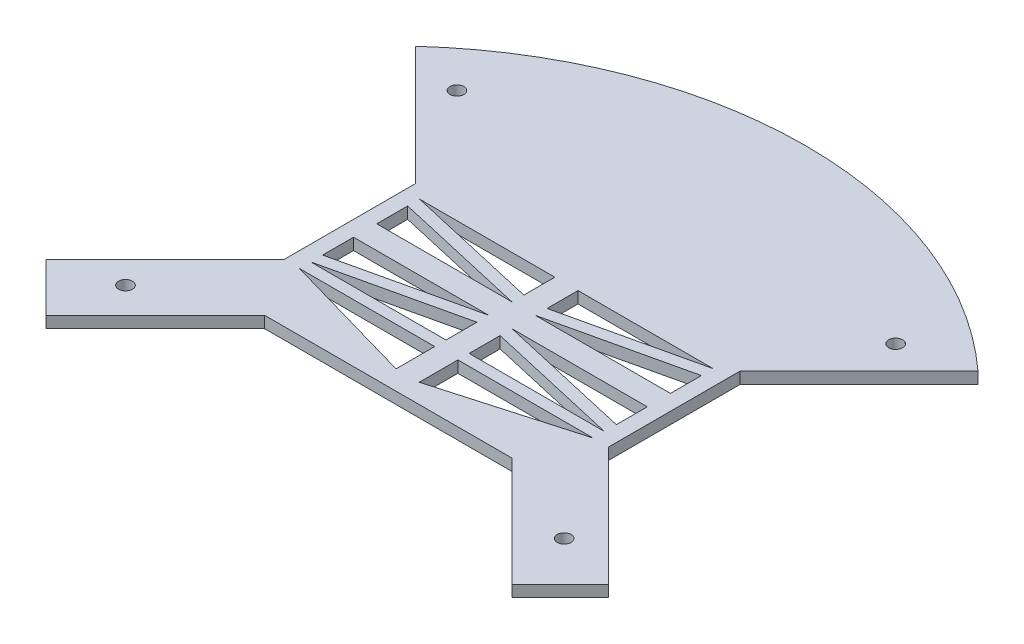
from build123d import *

# Parameters (mm, degrees)
BOSS_EXTRUDE1_DEPTH = 3
SKETCH5_R           = 1.8
CUT_EXTRUDE2_DEPTH  = 106.270616959
CUT_EXTRUDE3_DEPTH  = 106.270616959


with BuildPart() as part:
    # Sketch2 → Boss-Extrude1 (new body)
    with BuildSketch(Plane(origin=(0, 0, 0), x_dir=(1, 0, 0), z_dir=(0, 1, 0))):
        with BuildLine():
            Line((-42, 17), (-42, -17))
            Line((-42, -17), (-72.784271247, -47.784271247))
            Line((-72.784271247, -47.784271247), (-60.284271247, -60.284271247))
            Line((-60.284271247, -60.284271247), (-32, -32))
            Line((-32, -32), (32, -32))
            Line((32, -32), (60.284271247, -60.284271247))
            Line((60.284271247, -60.284271247), (72.784271247, -47.784271247))
            Line((72.784271247, -47.784271247), (42, -17))
            Line((42, -17), (42, 17))
            Line((42, 17), (72.784271247, 47.784271247))
            ThreePointArc((72.784271247, 47.784271247), (0, 75.995741025), (-72.784271247, 47.784271247))
            Line((-72.784271247, 47.784271247), (-42, 17))
        make_face()
    extrude(amount=BOSS_EXTRUDE1_DEPTH)

    # Sketch5 → Cut-Extrude2 (cut, through all)
    with BuildSketch(Plane(origin=(0, 3, 0), x_dir=(1, 0, 0), z_dir=(0, 1, 0))):
        with Locations(Location((-57.5, 43.25, 0), (0, 0, 270))):
            Circle(SKETCH5_R)
        with Locations(Location((56, 43.25, 0), (0, 0, 270))):
            Circle(SKETCH5_R)
        with Locations(Location((56.75, -43.25, 0), (0, 0, 270))):
            Circle(SKETCH5_R)
        with Locations(Location((-56.75, -43.25, 0), (0, 0, 270))):
            Circle(SKETCH5_R)
    extrude(amount=-CUT_EXTRUDE2_DEPTH, mode=Mode.SUBTRACT)

    # Sketch6 → Cut-Extrude3 (cut, through all)
    with BuildSketch(Plane(origin=(0, 3, 0), x_dir=(1, 0, 0), z_dir=(0, 1, 0))):
        Polygon((-38, 14.077369669), (-3, 14.077369669), (-3, 6.077369669), align=None)
        Polygon((-38, 11), (-3, 3), (-38, 3), align=None)
        Polygon((-3, -14.077369669), (-3, -6.077369669), (-38, -14.077369669), align=None)
        Polygon((-3, -3), (-38, -3), (-38, -11), align=None)
        Polygon((38, -14.077369669), (3, -14.077369669), (3, -6.077369669), align=None)
        Polygon((38, -11), (3, -3), (38, -3), align=None)
        Polygon((3, 3), (38, 3), (38, 11), align=None)
        Polygon((3, 14.077369669), (3, 6.077369669), (38, 14.077369669), align=None)
        Polygon((-38, -17), (-3, -17), (-3, -27), align=None)
        Polygon((3, -17), (3, -27), (38, -17), align=None)
    extrude(amount=-CUT_EXTRUDE3_DEPTH, mode=Mode.SUBTRACT)


solid = part.part
